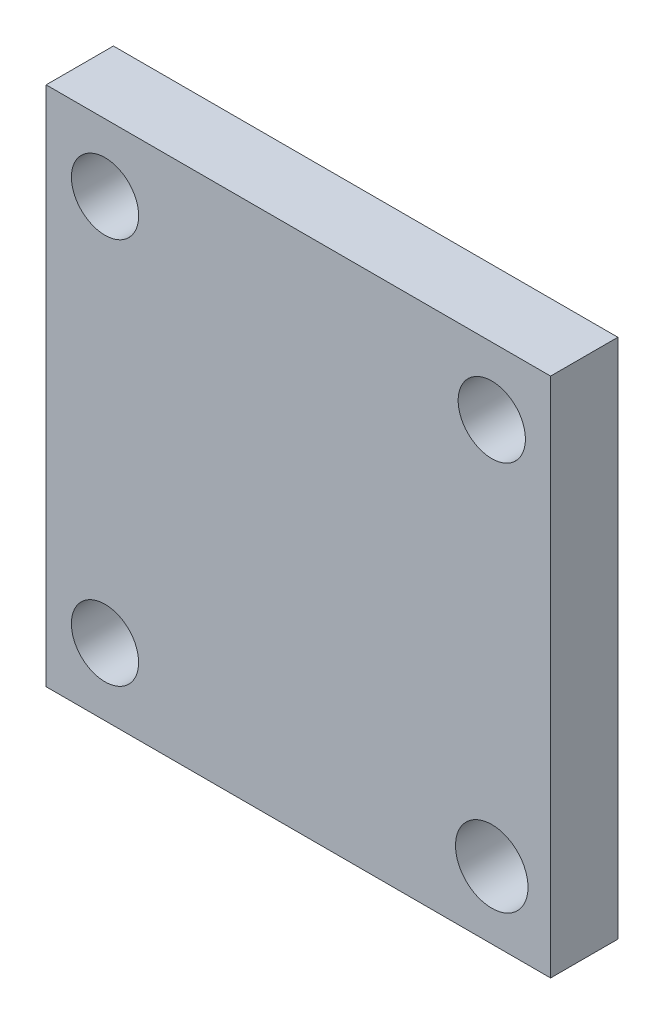
from build123d import *

# Parameters (mm, degrees)
SKETCH1_W           = 30.002183488
SKETCH1_H           = 31.002183488
SKETCH1_R           = 2.156266898
SKETCH1_R_2         = 2
BOSS_EXTRUDE1_DEPTH = 4


with BuildPart() as part:
    # Sketch1 → Boss-Extrude1 (new body)
    with BuildSketch(Plane(origin=(0, 0, 0), x_dir=(-1, 0, 0), z_dir=(0, 0, -1))):
        Rectangle(SKETCH1_W, SKETCH1_H)
        with Locations(Location((-11.501091744, -11.501091744, 0), (0, 0, 180))):
            Circle(SKETCH1_R, mode=Mode.SUBTRACT)
        with Locations(Location((11.501091744, -11.498908256, 0), (0, 0, 180))):
            Circle(SKETCH1_R_2, mode=Mode.SUBTRACT)
        with Locations(Location((-11.503275233, 11.501091744, 0), (0, 0, 180))):
            Circle(SKETCH1_R_2, mode=Mode.SUBTRACT)
        with Locations(Location((11.498908256, 11.503275233, 0), (0, 0, 180))):
            Circle(SKETCH1_R_2, mode=Mode.SUBTRACT)
    extrude(amount=-BOSS_EXTRUDE1_DEPTH)


solid = part.part
